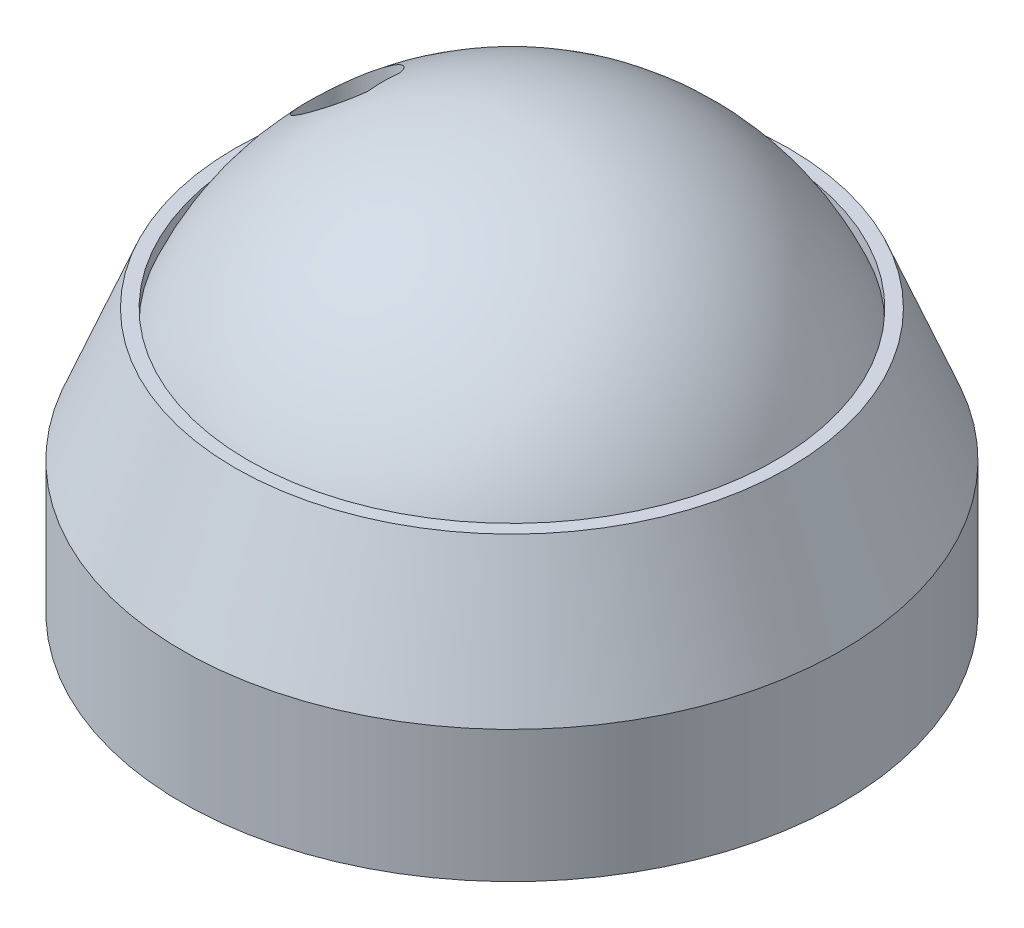
from build123d import *

# Parameters (mm, degrees)
ECHELLE1_SCALE          = 0.6
ESQUISSE3_R             = 7.5
BOSS_EXTRU_1_DEPTH      = 10
ESQUISSE4_R             = 2.75
ENL_V_MAT_EXTRU_1_DEPTH = 27


with BuildPart() as part:
    # Esquisse2 → Révolution1 (revolve)
    with BuildSketch(Plane.XY, mode=Mode.PRIVATE) as r_volution1_sk:
        with BuildLine():
            Line((0, 0), (37.5, 0))
            Line((37.5, 0), (37.5, 15))
            Line((37.5, 15), (31.5, 30))
            Line((31.5, 30), (30, 30))
            Line((30, 30), (30, 28.5))
            ThreePointArc((30, 28.5), (18.027756377, 43.041634566), (0, 48.5))
            Line((0, 48.5), (0, 0))
        make_face()
    revolve(r_volution1_sk.sketch.rotate(Axis((0, 0, 0), (0, 1, 0)), 90), axis=Axis((0, 0, 0), (0, 1, 0)))


with BuildPart() as part_1:
    # Echelle1: scaled about (0, 0, 0)
    add(part.part.scale(ECHELLE1_SCALE))

    # Esquisse3 → Boss.-Extru.1 (add)
    with BuildSketch(Plane(origin=(0, 0, 0), x_dir=(-1, 0, 0), z_dir=(0, -1, 0))):
        with Locations(Location((0, 0, 0), (0, 0, 90))):
            Circle(ESQUISSE3_R)
    extrude(amount=BOSS_EXTRU_1_DEPTH)

    # Esquisse4 → Enlèv. mat.-Extru.1 (cut)
    with BuildSketch(Plane(origin=(0, 0, 0), x_dir=(-1, 0, 0), z_dir=(0, -1, 0))):
        with Locations(Location((11.25, 0, 0), (0, 0, 90))):
            Circle(ESQUISSE4_R)
    extrude(amount=-ENL_V_MAT_EXTRU_1_DEPTH, mode=Mode.SUBTRACT)


solid = part_1.part
